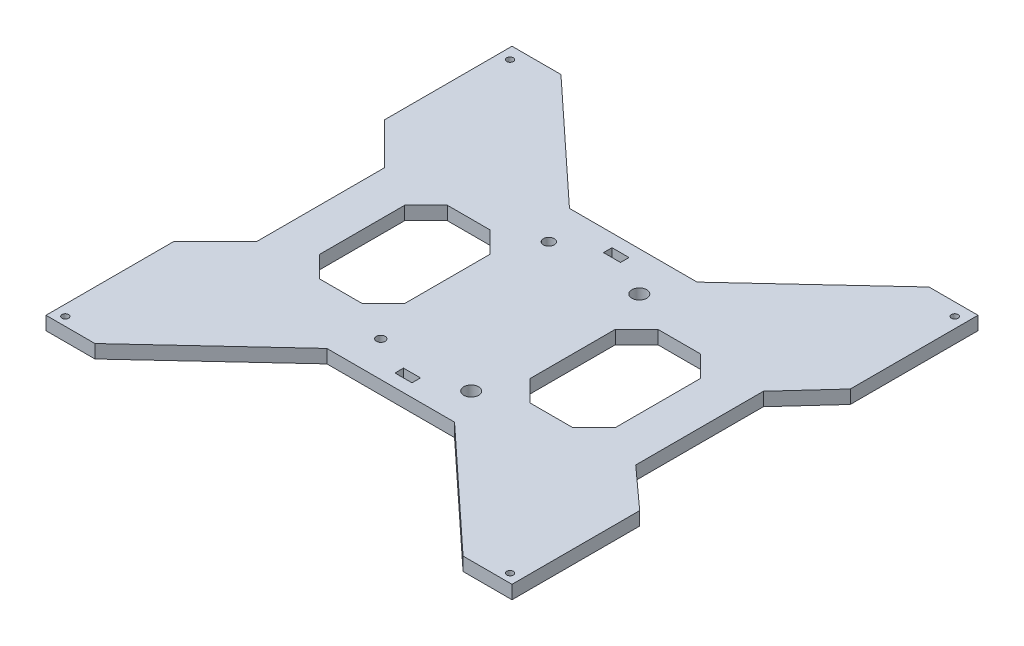
from build123d import *

# Parameters (mm, degrees)
BOSS_EXTRUDE1_DEPTH = 6.3
SKETCH3_W           = 8
SKETCH3_H           = 4
SKETCH3_W_2         = 40
SKETCH3_H_2         = 60
CUT_EXTRUDE1_DEPTH  = 310.776839031
CHAMFER1_SIZE       = 10
SKETCH4_R           = 1.55
SKETCH4_R_2         = 2.55
SKETCH4_R_3         = 2.05
SKETCH4_R_4         = 3.5
CUT_EXTRUDE2_DEPTH  = 310.776839031


with BuildPart() as part:
    # Sketch1 → Boss-Extrude1 (new body)
    with BuildSketch(Plane(origin=(0, 0, 0), x_dir=(1, 0, 0), z_dir=(0, 1, 0))):
        Polygon((0, 0), (23, 0), (79.5, 52.5), (139.5, 52.5), (196, 0), (219, 0), (219, 60), (199.5, 77.642351694), (199.5, 137.642351694), (219, 159), (219, 219), (196, 219), (139.5, 166.5), (79.5, 166.5), (23, 219), (0, 219), (0, 159), (19.5, 139.5), (19.5, 79.5), (0, 60), align=None)
    extrude(amount=BOSS_EXTRUDE1_DEPTH)

    # Sketch3 → Cut-Extrude1 (cut, through all)
    with BuildSketch(Plane(origin=(0, 6.3, 0), x_dir=(1, 0, 0), z_dir=(0, 1, 0))):
        with Locations((109.5, 158.5)):
            Rectangle(SKETCH3_W, SKETCH3_H)
        with Locations((109.5, 60.5)):
            Rectangle(SKETCH3_W, SKETCH3_H)
        with Locations((59.5, 109.087189265)):
            Rectangle(SKETCH3_W_2, SKETCH3_H_2)
        with Locations((159.5, 108.055162429)):
            Rectangle(SKETCH3_W_2, SKETCH3_H_2)
    extrude(amount=-CUT_EXTRUDE1_DEPTH, mode=Mode.SUBTRACT)

    # Chamfer1
    chamfer1_edges = [part.edges().sort_by_distance(p)[0] for p in [
        (79.5, 3.15, -139.087189265),
        (79.5, 3.15, -79.087189265),
        (39.5, 3.15, -79.087189265),
        (39.5, 3.15, -139.087189265),
        (179.5, 3.15, -138.055162429),
        (179.5, 3.15, -78.055162429),
        (139.5, 3.15, -78.055162429),
        (139.5, 3.15, -138.055162429),
    ]]
    chamfer(chamfer1_edges, length=CHAMFER1_SIZE)

    # Sketch4 → Cut-Extrude2 (cut, through all)
    with BuildSketch(Plane(origin=(0, 6.3, 0), x_dir=(1, 0, 0), z_dir=(0, 1, 0))):
        with Locations(Location((5, 213.071175847, 0), (0, 0, 270))):
            Circle(SKETCH4_R)
        with Locations(Location((214, 213.071175847, 0), (0, 0, 270))):
            Circle(SKETCH4_R)
        with Locations(Location((214, 4.071175847, 0), (0, 0, 270))):
            Circle(SKETCH4_R)
        with Locations(Location((5, 4.071175847, 0), (0, 0, 270))):
            Circle(SKETCH4_R)
        with Locations(Location((88.25, 148.071175847, 0), (0, 0, 270))):
            Circle(SKETCH4_R_2)
        with Locations(Location((88.25, 69.071175847, 0), (0, 0, 270))):
            Circle(SKETCH4_R_3)
        with Locations(Location((130.75, 69.071175847, 0), (0, 0, 270))):
            Circle(SKETCH4_R_4)
        with Locations(Location((130.75, 148.071175847, 0), (0, 0, 270))):
            Circle(SKETCH4_R_4)
    extrude(amount=-CUT_EXTRUDE2_DEPTH, mode=Mode.SUBTRACT)


solid = part.part
